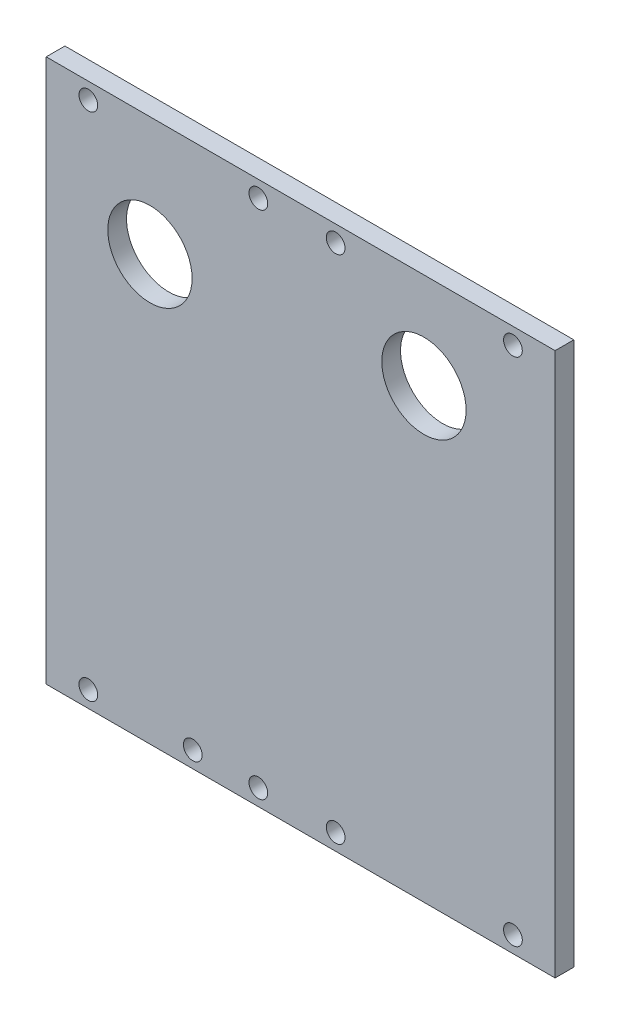
from build123d import *

# Parameters (mm, degrees)
SKETCH1_W           = 108.65
SKETCH1_H           = 116
BOSS_EXTRUDE1_DEPTH = 4
SKETCH2_R           = 9
CUT_EXTRUDE1_DEPTH  = 80.568873468
SKETCH4_R           = 2
CUT_EXTRUDE2_DEPTH  = 80.568873468


with BuildPart() as part:
    # Sketch1 → Boss-Extrude1 (new body)
    with BuildSketch(Plane.XY):
        Rectangle(SKETCH1_W, SKETCH1_H)
    extrude(amount=BOSS_EXTRUDE1_DEPTH)

    # Sketch2 → Cut-Extrude1 (cut, through all)
    with BuildSketch(Plane.XY.offset(4)):
        with Locations((26.325, 37.5)):
            Circle(SKETCH2_R)
        with Locations((-32.175, 32.6)):
            Circle(SKETCH2_R)
    extrude(amount=-CUT_EXTRUDE1_DEPTH, mode=Mode.SUBTRACT)

    # Sketch4 → Cut-Extrude2 (cut, through all)
    with BuildSketch(Plane.XY.offset(4)):
        with Locations((-45.325, 54.5)):
            Circle(SKETCH4_R)
        with Locations(Location((-45.325, -54.5, 0), (0, 0, 180))):
            Circle(SKETCH4_R)
        with Locations(Location((-9.025, 54.5, 0), (0, 0, 180))):
            Circle(SKETCH4_R)
        with Locations((-9.025, -54.5)):
            Circle(SKETCH4_R)
        with Locations(Location((-23.025, -54.5, 0), (0, 0, 180))):
            Circle(SKETCH4_R)
        with Locations((7.475, 54.5)):
            Circle(SKETCH4_R)
        with Locations(Location((7.475, -54.5, 0), (0, 0, 180))):
            Circle(SKETCH4_R)
        with Locations((45.325, 54.5)):
            Circle(SKETCH4_R)
        with Locations(Location((45.325, -54.5, 0), (0, 0, 180))):
            Circle(SKETCH4_R)
    extrude(amount=-CUT_EXTRUDE2_DEPTH, mode=Mode.SUBTRACT)


solid = part.part
